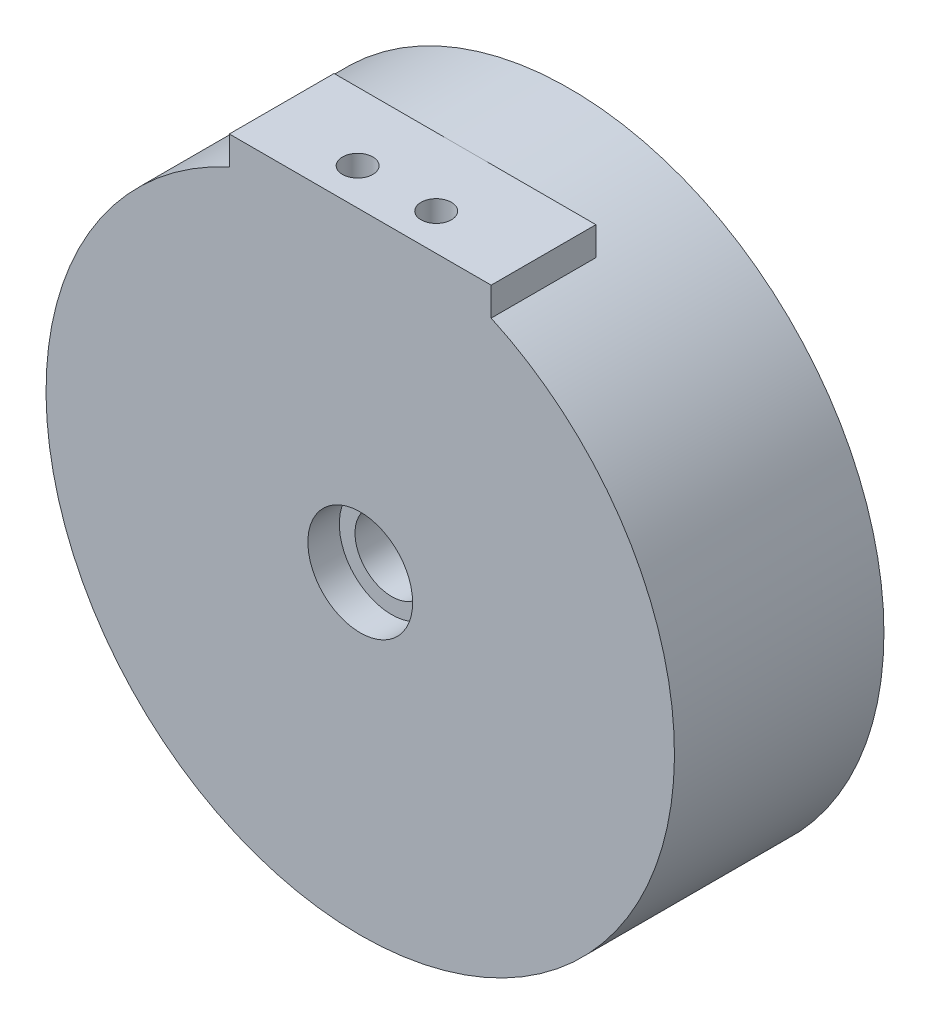
from build123d import *

# Parameters (mm, degrees)
SKETCH_1_R          = 30
EXTRUDE_1_DEPTH     = 20
EXTRUDE_2_DEPTH     = 10
EXTRUDE_3_DEPTH     = 10
CUT_EXTRUDE_1_DEPTH = 10
SKETCH_5_R          = 1.45
CUT_EXTRUDE_2_DEPTH = 3
SKETCH_7_R          = 3.5
CUT_EXTRUDE_4_DEPTH = 47.904157598
SKETCH_8_R          = 5
CUT_EXTRUDE_5_DEPTH = 3


with BuildPart() as part:
    # 草图1 → 凸台-拉伸1 (new body)
    with BuildSketch(Plane.XY):
        Circle(SKETCH_1_R)
    extrude(amount=EXTRUDE_1_DEPTH)

    # 草图2 → 凸台-拉伸2 (add)
    with BuildSketch(Plane(origin=(0, 0, 0), x_dir=(-1, 0, 0), z_dir=(0, 0, -1))):
        with BuildLine():
            Line((0, 30), (-12.5, 30))
            Line((-12.5, 30), (-12.5, 27.271780287))
            ThreePointArc((-12.5, 27.271780287), (-6.397131834, 29.310010309), (0, 30))
        make_face()
        with BuildLine():
            Line((12.5, 30), (0, 30))
            ThreePointArc((0, 30), (6.397131834, 29.310010309), (12.5, 27.271780287))
            Line((12.5, 27.271780287), (12.5, 30))
        make_face()
    extrude(amount=-EXTRUDE_2_DEPTH)

    # 草图3 → 凸台-拉伸3 (add)
    with BuildSketch(Plane.XY.offset(10)):
        with BuildLine():
            Line((-12.5, 30), (-12.5, 27.271780287))
            ThreePointArc((-12.5, 27.271780287), (-6.397131834, 29.310010309), (0, 30))
            Line((0, 30), (-12.5, 30))
        make_face()
        with BuildLine():
            ThreePointArc((0, 30), (6.397131834, 29.310010309), (12.5, 27.271780287))
            Line((12.5, 27.271780287), (12.5, 30))
            Line((12.5, 30), (0, 30))
        make_face()
    extrude(amount=EXTRUDE_3_DEPTH)

    # 草图4 → 切除-拉伸1 (cut)
    with BuildSketch(Plane(origin=(0, 0, 0), x_dir=(-1, 0, 0), z_dir=(0, 0, -1))):
        with BuildLine():
            Line((-12.5, 30), (-12.5, 27.271780287))
            ThreePointArc((-12.5, 27.271780287), (-6.397131834, 29.310010309), (0, 30))
            Line((0, 30), (-12.5, 30))
        make_face()
        with BuildLine():
            ThreePointArc((0, 30), (6.397131834, 29.310010309), (12.5, 27.271780287))
            Line((12.5, 27.271780287), (12.5, 30))
            Line((12.5, 30), (0, 30))
        make_face()
    extrude(amount=-CUT_EXTRUDE_1_DEPTH, mode=Mode.SUBTRACT)

    # 草图5 → 切除-拉伸2 (cut)
    with BuildSketch(Plane(origin=(0, 30, 0), x_dir=(1, 0, 0), z_dir=(0, 1, 0))):
        with Locations((-3.75, -16.5)):
            Circle(SKETCH_5_R)
        with Locations((3.75, -16.5)):
            Circle(SKETCH_5_R)
    extrude(amount=-CUT_EXTRUDE_2_DEPTH, mode=Mode.SUBTRACT)

    # 草图7 → 切除-拉伸4 (cut, through all)
    with BuildSketch(Plane.XY.offset(20)):
        Circle(SKETCH_7_R)
    extrude(amount=-CUT_EXTRUDE_4_DEPTH, mode=Mode.SUBTRACT)

    # 草图8 → 切除-拉伸5 (cut)
    with BuildSketch(Plane.XY.offset(20)):
        Circle(SKETCH_8_R)
    extrude(amount=-CUT_EXTRUDE_5_DEPTH, mode=Mode.SUBTRACT)


solid = part.part
